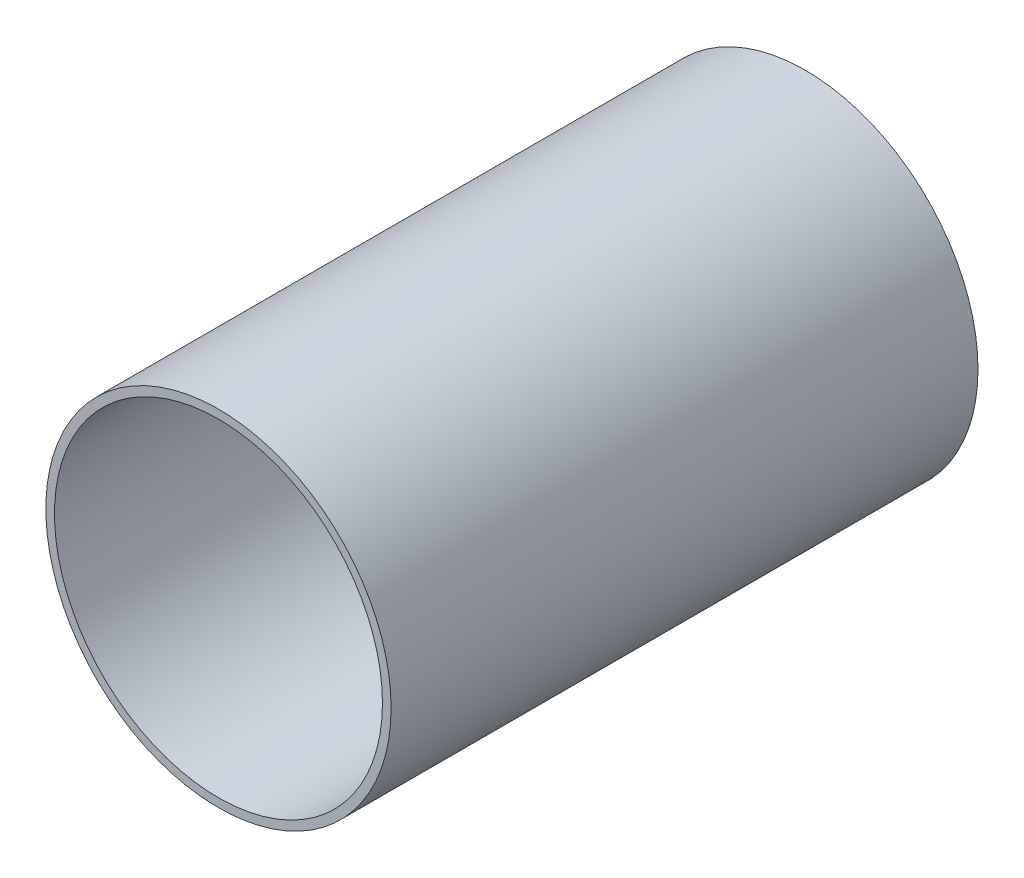
from build123d import *

# Parameters (mm, degrees)
SKETCH1_R           = 10
BOSS_EXTRUDE1_DEPTH = 1
SKETCH2_R           = 10
SKETCH2_R_2         = 9.5
BOSS_EXTRUDE2_DEPTH = 33
CHAMFER1_SIZE       = 1


with BuildPart() as part:
    # Sketch1 → Boss-Extrude1 (new body)
    with BuildSketch(Plane.XY):
        Circle(SKETCH1_R)
    extrude(amount=BOSS_EXTRUDE1_DEPTH)

    # Sketch2 → Boss-Extrude2 (add)
    with BuildSketch(Plane.XY.offset(1)):
        Circle(SKETCH2_R)
        Circle(SKETCH2_R_2, mode=Mode.SUBTRACT)
    extrude(amount=BOSS_EXTRUDE2_DEPTH)

    # Chamfer1
    chamfer1_edges = [part.edges().sort_by_distance(p)[0] for p in [
        (-9.5, 0, 1),
    ]]
    chamfer(chamfer1_edges, length=CHAMFER1_SIZE)


solid = part.part
